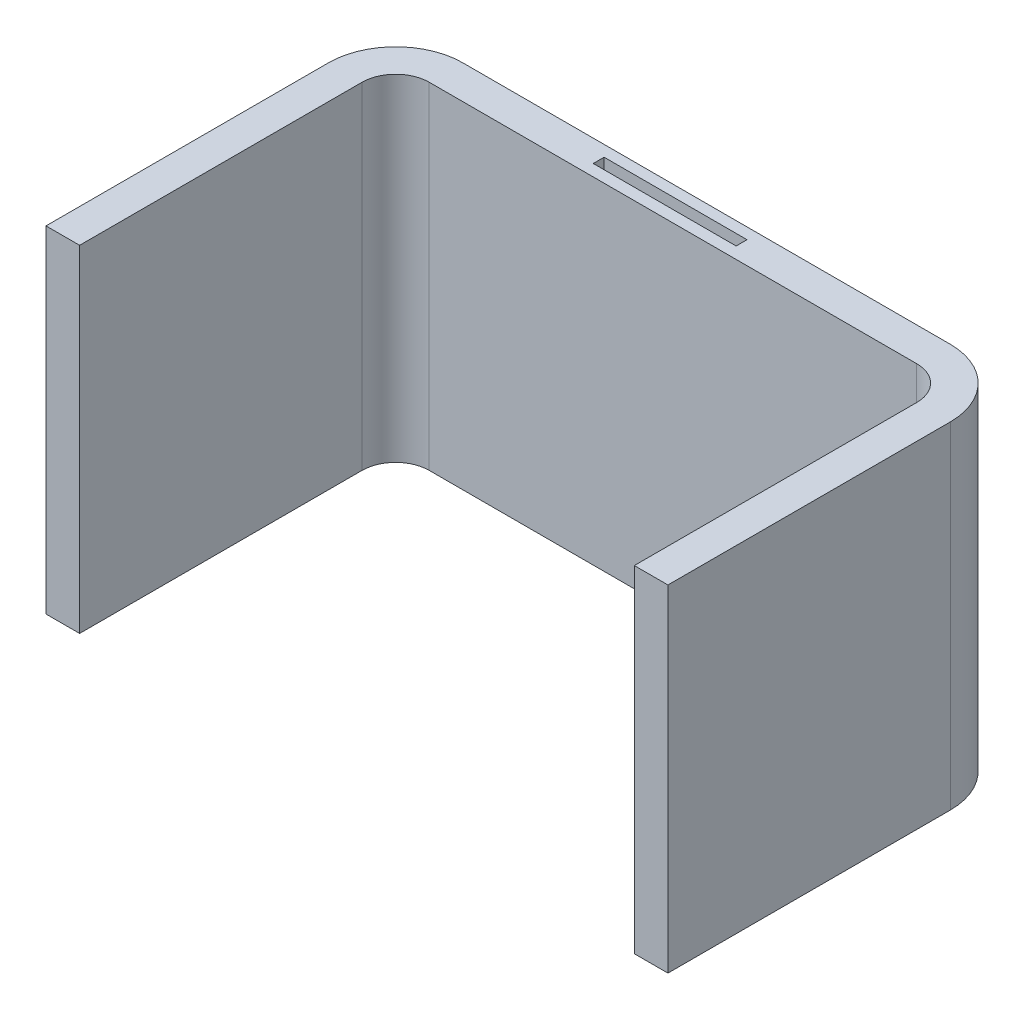
from build123d import *

# Parameters (mm, degrees)
SKETCH1_W           = 8.501053498
SKETCH1_H           = 0.647699314
BOSS_EXTRUDE2_DEPTH = 20


with BuildPart() as part:
    # Sketch1 → Boss-Extrude2 (new body)
    with BuildSketch(Plane(origin=(0, 0, 0), x_dir=(1, 0, 0), z_dir=(0, 1, 0))):
        with BuildLine():
            Line((-16.328355949, -0.789632586), (-16.328355949, 9.010367414))
            Line((-16.328355949, 9.010367414), (-16.328355949, 16.010367414))
            ThreePointArc((-16.328355949, 16.010367414), (-15.742569512, 17.424580976), (-14.328355949, 18.010367414))
            Line((-14.328355949, 18.010367414), (14.671644051, 18.010367414))
            ThreePointArc((14.671644051, 18.010367414), (16.085857613, 17.424580976), (16.671644051, 16.010367414))
            Line((16.671644051, 16.010367414), (16.671644051, 9.010367414))
            Line((16.671644051, 9.010367414), (16.671644051, -0.789632586))
            Line((16.671644051, -0.789632586), (18.671644051, -0.789632586))
            Line((18.671644051, -0.789632586), (18.671644051, 9.010367414))
            Line((18.671644051, 9.010367414), (18.671644051, 16.010367414))
            ThreePointArc((18.671644051, 16.010367414), (17.500071175, 18.838794538), (14.671644051, 20.010367414))
            Line((14.671644051, 20.010367414), (-14.328355949, 20.010367414))
            ThreePointArc((-14.328355949, 20.010367414), (-17.156783074, 18.838794538), (-18.328355949, 16.010367414))
            Line((-18.328355949, 16.010367414), (-18.328355949, 9.010367414))
            Line((-18.328355949, 9.010367414), (-18.328355949, -0.789632586))
            Line((-18.328355949, -0.789632586), (-16.328355949, -0.789632586))
        make_face()
        with Locations((-1.014089745, 19.027186225)):
            Rectangle(SKETCH1_W, SKETCH1_H, mode=Mode.SUBTRACT)
    extrude(amount=BOSS_EXTRUDE2_DEPTH)


solid = part.part
